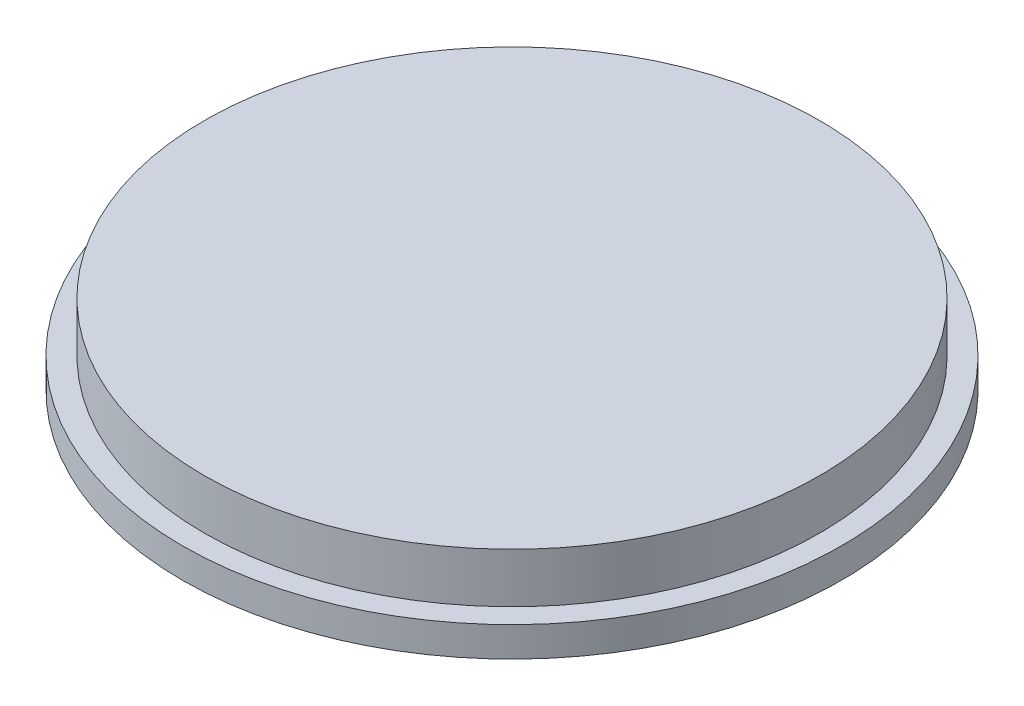
from build123d import *

# Parameters (mm, degrees)
SKETCH1_R           = 33.1
BOSS_EXTRUDE1_DEPTH = 3
SKETCH2_R           = 30.9
BOSS_EXTRUDE2_DEPTH = 5


with BuildPart() as part:
    # Sketch1 → Boss-Extrude1 (new body)
    with BuildSketch(Plane(origin=(0, 0, 0), x_dir=(1, 0, 0), z_dir=(0, 1, 0))):
        with Locations(Location((0, 0, 0), (0, 0, 270))):
            Circle(SKETCH1_R)
    extrude(amount=BOSS_EXTRUDE1_DEPTH)

    # Sketch2 → Boss-Extrude2 (add)
    with BuildSketch(Plane(origin=(0, 3, 0), x_dir=(1, 0, 0), z_dir=(0, 1, 0))):
        with Locations(Location((0, 0, 0), (0, 0, 270))):
            Circle(SKETCH2_R)
    extrude(amount=BOSS_EXTRUDE2_DEPTH)


solid = part.part
